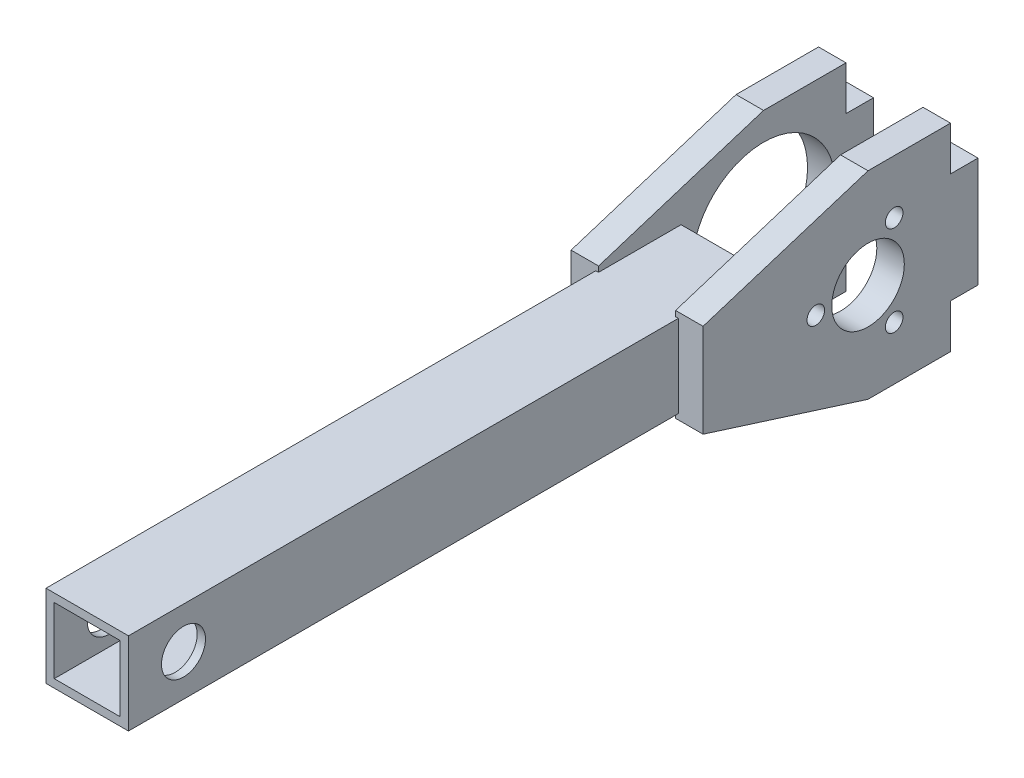
from build123d import *

# Parameters (mm, degrees)
SKETCH_3_R           = 6.6
SKETCH_3_R_2         = 1.6
EXTRUDE_1_DEPTH      = 5
SKETCH_5_R           = 13
EXTRUDE_2_DEPTH      = 5
EXTRUDE_3_DEPTH      = 100
EXTRUDE_3_DEPTH_BACK = 15
SKETCH_6_W           = 15
SKETCH_6_H           = 15
SKETCH_6_W_2         = 12
SKETCH_6_H_2         = 12
SKETCH_7_R           = 4
CUT_EXTRUDE_1_DEPTH  = 148.408446162


with BuildPart() as part:
    # ｽｹｯﾁ3 → ﾎﾞｽ - 押し出し1 (new body)
    with BuildSketch(Plane(origin=(7, 0, 0), x_dir=(0, 0, -1), z_dir=(1, 0, 0))):
        Polygon((5, 10), (5, -10), (0, -10), (0, -18), (-15, -18), (-45, -8.5), (-45, 8.5), (-15, 18), (0, 18), (0, 10), align=None)
        with Locations((-15, 0)):
            Circle(SKETCH_3_R, mode=Mode.SUBTRACT)
        with Locations((-24.5, 0)):
            Circle(SKETCH_3_R_2, mode=Mode.SUBTRACT)
        with Locations((-10.25, 8.227241336)):
            Circle(SKETCH_3_R_2, mode=Mode.SUBTRACT)
        with Locations((-10.25, -8.227241336)):
            Circle(SKETCH_3_R_2, mode=Mode.SUBTRACT)
    extrude(amount=EXTRUDE_1_DEPTH)



with BuildPart() as body_2:
    # ｽｹｯﾁ5 → ﾎﾞｽ - 押し出し2 (new body)
    with BuildSketch(Plane(origin=(-7, 0, 0), x_dir=(0, 0, -1), z_dir=(1, 0, 0))):
        Polygon((-45, -8.5), (-45, 8.5), (-15, 18), (0, 18), (0, 10), (5, 10), (5, -10), (0, -10), (0, -18), (-15, -18), align=None)
        with Locations((-15, 0)):
            Circle(SKETCH_5_R, mode=Mode.SUBTRACT)
    extrude(amount=-EXTRUDE_2_DEPTH)


with BuildPart() as part_1:
    add(part.part)

    add(body_2.part)  # ﾎﾞｽ - 押し出し3 merges body 2
    # ｽｹｯﾁ6 → ﾎﾞｽ - 押し出し3 (add, two sides: drawn at the far end of the back side and taken through both)
    with BuildSketch(Plane.XY.offset(45).offset(-EXTRUDE_3_DEPTH_BACK)):
        Rectangle(SKETCH_6_W, SKETCH_6_H)
        Rectangle(SKETCH_6_W_2, SKETCH_6_H_2, mode=Mode.SUBTRACT)
    extrude(amount=EXTRUDE_3_DEPTH + EXTRUDE_3_DEPTH_BACK)

    # ｽｹｯﾁ7 → ｶｯﾄ - 押し出し1 (cut, through all)
    with BuildSketch(Plane(origin=(7.5, 0, 0), x_dir=(0, 0, -1), z_dir=(1, 0, 0))):
        with Locations((-135, 0)):
            Circle(SKETCH_7_R)
    extrude(amount=-CUT_EXTRUDE_1_DEPTH, mode=Mode.SUBTRACT)


solid = part_1.part
